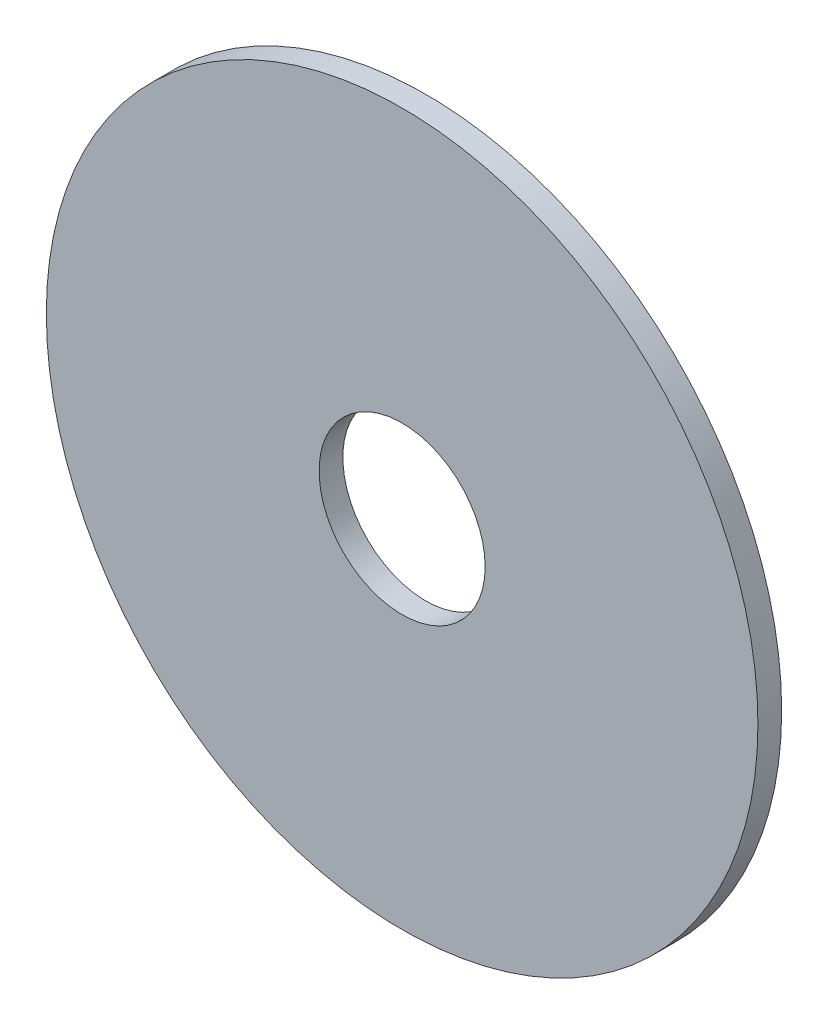
from build123d import *

# Parameters (mm, degrees)
CROQUIS1_R              = 15
CROQUIS1_R_2            = 3.5
SALIENTE_EXTRUIR1_DEPTH = 1


with BuildPart() as part:
    # Croquis1 → Saliente-Extruir1 (new body)
    with BuildSketch(Plane.XY):
        Circle(CROQUIS1_R)
        Circle(CROQUIS1_R_2, mode=Mode.SUBTRACT)
    extrude(amount=SALIENTE_EXTRUIR1_DEPTH)


solid = part.part
